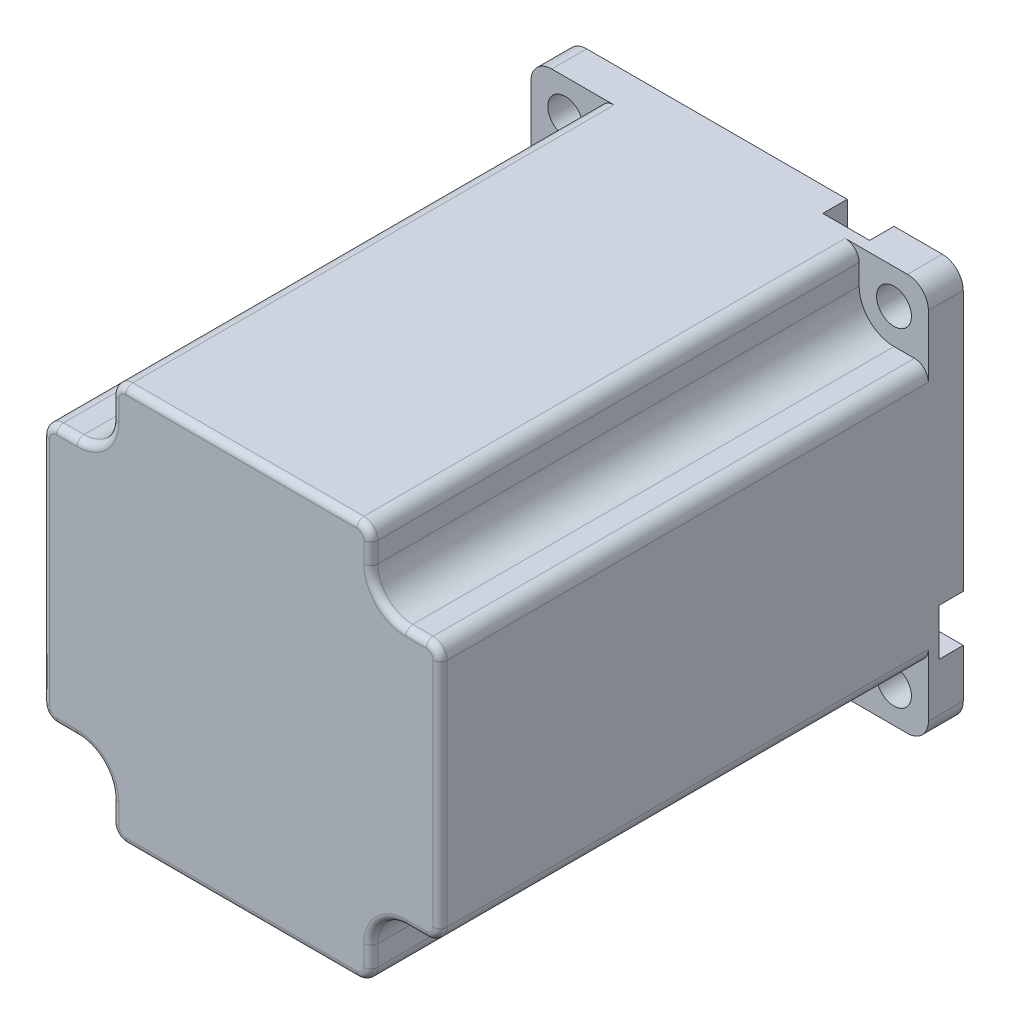
from build123d import *

# Parameters (mm, degrees)
BOSS_EXTRUDE1_DEPTH          = 54.00000000000001
CUT_EXTRUDE1_REACH           = 79.096
SKETCH4_W                    = 49.00000000000001
SKETCH4_H                    = 9.930000000000003
CUT_EXTRUDE2_DEPTH           = 9.930000000000001
CUT_EXTRUDE3_DEPTH           = 9.930000000000001
CUT_EXTRUDE4_REACH           = 79.096
CUT_EXTRUDE5_DEPTH           = 3.5
CUT_EXTRUDE6_DEPTH           = 3.5
CUT_EXTRUDE7_DEPTH           = 3.5
CUT_EXTRUDE8_DEPTH           = 3.5
DRAFT1_ANGLE                 = 0.01722183664478431
F_5_0_5_DIAMETER_HOLE1_D     = 5
F_5_0_5_DIAMETER_HOLE1_DEPTH = 29.6
F_5_0_5_DIAMETER_HOLE2_D     = 5
F_5_0_5_DIAMETER_HOLE2_DEPTH = 26.5
FILLET1_R                    = 2
FILLET2_R                    = 5
FILLET3_R                    = 0.4999999999999998
FILLET5_R                    = 2.9999999999999996
BOSS_EXTRUDE2_DEPTH          = 21
FILLET4_R                    = 0.9999999999999991


with BuildPart() as part:
    # Sketch1 → Boss-Extrude1 (new body)
    with BuildSketch(Plane(origin=(0, 0, 0), x_dir=(-1, 0, 0), z_dir=(0, 0, -1))):
        Polygon((-28.5, 28.5), (-28.5, -28.51414849795304), (28.5, -28.49701556553382), (28.5, 28.5), align=None)
    extrude(amount=-BOSS_EXTRUDE1_DEPTH)

    # Cut-Extrude1: up to this plane
    cut_extrude1_end = Plane(origin=(28.5, -28.51414849795304, 54.00000000000001), z_dir=(-0.0003005777481625158, -0.9999999548265077, 0))
    # Sketch3 → Cut-Extrude1 (cut, up to the surface)
    with BuildSketch(Plane(origin=(0, -18.57, 0), x_dir=(1, 0, 0), z_dir=(0, 1, 0)), mode=Mode.PRIVATE) as cut_extrude1_sk1:
        Polygon((28.499999999999996, -5.000000000000003), (18.57, -5.000000000000004), (18.570000000000004, -54), (28.499999999999996, -53.99999999999999), align=None)
    cut_extrude1_tool1 = split(extrude(cut_extrude1_sk1.sketch, amount=-CUT_EXTRUDE1_REACH, mode=Mode.PRIVATE), bisect_by=cut_extrude1_end, keep=Keep.BOTH, mode=Mode.PRIVATE)
    add(cut_extrude1_tool1.solids().sort_by_distance((23.535, -18.57, 29.5))[0], mode=Mode.SUBTRACT)

    # Sketch4 → Cut-Extrude2 (cut)
    with BuildSketch(Plane(origin=(28.5, 0, 0), x_dir=(0, 0, -1), z_dir=(1, 0, 0))):
        with Locations((-29.500000000000004, 23.535000000000004)):
            Rectangle(SKETCH4_W, SKETCH4_H)
    extrude(amount=-CUT_EXTRUDE2_DEPTH, mode=Mode.SUBTRACT)

    # Sketch5 → Cut-Extrude3 (cut)
    with BuildSketch(Plane(origin=(0, 28.5, 0), x_dir=(-1, 0, 0), z_dir=(0, 1, 0))):
        Polygon((18.570000000000004, 5.000000000000003), (28.499999999999996, 5.000000000000003), (28.5, 54), (18.57, 54), align=None)
    extrude(amount=-CUT_EXTRUDE3_DEPTH, mode=Mode.SUBTRACT)

    # Cut-Extrude4: up to this plane
    cut_extrude4_end = Plane(origin=(28.5, -28.51414849795304, 54.00000000000001), z_dir=(-0.0003005777481625158, -0.9999999548265077, 0))
    # Sketch7 → Cut-Extrude4 (cut, up to the surface)
    with BuildSketch(Plane(origin=(0, -18.57, 0), x_dir=(1, 0, 0), z_dir=(0, 1, 0)), mode=Mode.PRIVATE) as cut_extrude4_sk1:
        Polygon((-18.569999999999997, -5.000000000000004), (-28.499999999999996, -5.000000000000003), (-28.5, -54), (-18.569999999999997, -53.99999999999999), align=None)
    cut_extrude4_tool1 = split(extrude(cut_extrude4_sk1.sketch, amount=-CUT_EXTRUDE4_REACH, mode=Mode.PRIVATE), bisect_by=cut_extrude4_end, keep=Keep.BOTH, mode=Mode.PRIVATE)
    add(cut_extrude4_tool1.solids().sort_by_distance((-23.535, -18.57, 29.5))[0], mode=Mode.SUBTRACT)

    # Sketch8 → Cut-Extrude5 (cut)
    with BuildSketch(Plane(origin=(0, 0, 0), x_dir=(-1, 0, 0), z_dir=(0, 0, -1))):
        with BuildLine():
            Line((18.5710070868336, -28.5), (18.569999848669397, -25.148993064543653))
            ThreePointArc((18.569999848669397, -25.148993064543653), (15.21959273974545, -21.800000024754763), (11.870000005525402, -25.149807585039706))
            Line((11.870000005525402, -25.149807585039706), (11.869807463820973, -28.502014231583665))
            Line((11.869807463820973, -28.502014231583665), (18.5710070868336, -28.5))
        make_face()
    extrude(amount=-CUT_EXTRUDE5_DEPTH, mode=Mode.SUBTRACT)

    # Sketch9 → Cut-Extrude6 (cut)
    with BuildSketch(Plane(origin=(0, 0, 0), x_dir=(-1, 0, 0), z_dir=(0, 0, -1))):
        with BuildLine():
            Line((-18.57, 28.5), (-18.57, 25.15))
            ThreePointArc((-18.57, 25.15), (-15.22, 21.799999999999997), (-11.87, 25.15))
            Line((-11.87, 25.15), (-11.87, 28.5))
            Line((-11.87, 28.5), (-18.57, 28.5))
        make_face()
    extrude(amount=-CUT_EXTRUDE6_DEPTH, mode=Mode.SUBTRACT)

    # Sketch10 → Cut-Extrude7 (cut)
    with BuildSketch(Plane(origin=(0, 0, 0), x_dir=(-1, 0, 0), z_dir=(0, 0, -1))):
        with BuildLine():
            Line((-25.15, -11.870000000000003), (-28.5, -11.87))
            Line((-28.5, -11.87), (-28.5, -18.57))
            Line((-28.5, -18.57), (-25.15, -18.57))
            ThreePointArc((-25.15, -18.57), (-21.799999999999997, -15.22), (-25.15, -11.870000000000003))
        make_face()
    extrude(amount=-CUT_EXTRUDE7_DEPTH, mode=Mode.SUBTRACT)

    # Sketch11 → Cut-Extrude8 (cut)
    with BuildSketch(Plane(origin=(0, 0, 0), x_dir=(-1, 0, 0), z_dir=(0, 0, -1))):
        with BuildLine():
            Line((28.5, 18.57), (25.15, 18.57))
            ThreePointArc((25.15, 18.57), (21.799999999999997, 15.22), (25.15, 11.869999999999992))
            Line((25.15, 11.869999999999992), (28.5, 11.87))
            Line((28.5, 11.87), (28.5, 18.57))
        make_face()
    extrude(amount=-CUT_EXTRUDE8_DEPTH, mode=Mode.SUBTRACT)

    # Draft1
    draft1_faces = [part.faces().sort_by_distance(p)[0] for p in [
        (0.17151026292326854, -28.505633583914378, 26.11567870035269),
    ]]
    draft(draft1_faces, Plane(origin=(-18.5710070868336, -28.5, 3.5), x_dir=(0.00030057774815282144, 0.9999999548265077, 0), z_dir=(0.9999999548265077, -0.00030057774815282144, 0)), DRAFT1_ANGLE)

    # Sketch12 → Revolve1 (revolve)
    with BuildSketch(Plane(origin=(0, 0, 0), x_dir=(1, 0, 0), z_dir=(0, 1, 0))):
        Polygon((3.2500000000000004, 24.6), (0, 24.6), (0, 0), (19.05, 0), (19.05, 1.6), (3.2500000000000004, 1.6000000000000008), align=None)
    revolve(axis=Axis((0, 0, -24.6), (0, 0, 1)))

    # Ø5.0 (5) Diameter Hole1
    with Locations(Plane.XY.offset(5.000000000000008)):
        with Locations((23.57, -23.57), (23.57, 23.57), (-23.57, 23.57), (-23.57, -23.57)):
            Hole(F_5_0_5_DIAMETER_HOLE1_D / 2, depth=F_5_0_5_DIAMETER_HOLE1_DEPTH)

    # Ø5.0 (5) Diameter Hole2
    with Locations(Plane(origin=(0, 0, 3.5), x_dir=(-1, 0, 0), z_dir=(0, 0, -1))):
        with Locations((15.22, -25.15), (-25.15, -15.22), (-15.22, 25.15), (25.15, 15.22)):
            Hole(F_5_0_5_DIAMETER_HOLE2_D / 2, depth=F_5_0_5_DIAMETER_HOLE2_DEPTH)

    # Fillet1
    fillet1_edges = [part.edges().sort_by_distance(p)[0] for p in [
        (28.499999999999996, -18.57, 29.499999999999996),
        (18.570000000000004, -28.49999999999951, 29.50000000000001),
        (18.57, 28.5, 29.500000000000004),
        (28.5, 18.57, 29.5),
        (-28.499999999999996, 18.57, 29.500000000000004),
        (-18.57, 28.5, 29.5),
        (-28.499999999999996, -18.57, 29.500000000000004),
        (-18.57, -28.5, 29.500000000000007),
    ]]
    fillet(fillet1_edges, radius=FILLET1_R)

    # Fillet2
    fillet2_edges = [part.edges().sort_by_distance(p)[0] for p in [
        (18.57, -18.57, 29.5),
        (18.57, 18.57, 29.5),
        (-18.57, 18.57, 29.5),
        (-18.569999999999997, -18.57, 29.5),
    ]]
    fillet(fillet2_edges, radius=FILLET2_R)

    # Fillet3
    fillet3_edges = [part.edges().sort_by_distance(p)[0] for p in [
        (-3.2500000000000004, 4e-16, -24.6),
    ]]
    fillet(fillet3_edges, radius=FILLET3_R)

    # Fillet5
    fillet5_edges = [part.edges().sort_by_distance(p)[0] for p in [
        (28.5, -28.499999999999375, 2.5000000000000013),
        (28.5, 28.5, 2.5000000000000013),
        (-28.5, 28.5, 2.5000000000000013),
        (-28.5, -28.500000000000135, 2.5000000000000013),
    ]]
    fillet(fillet5_edges, radius=FILLET5_R)

    # Sketch17 → Boss-Extrude2 (add)
    with BuildSketch(Plane.XY.offset(54.00000000000001)):
        with BuildLine():
            Line((-16.570000000000007, 28.5), (16.569999999999983, 28.5))
            ThreePointArc((16.569999999999983, 28.5), (17.98421356237308, 27.914213562373096), (18.57, 26.500000000000004))
            Line((18.57, 26.500000000000004), (18.57, 23.57))
            ThreePointArc((18.57, 23.57), (20.034466094067263, 20.034466094067263), (23.57, 18.57))
            Line((23.57, 18.57), (26.499999999999996, 18.57))
            ThreePointArc((26.499999999999996, 18.57), (27.914213562373096, 17.984213562373093), (28.5, 16.569999999999993))
            Line((28.5, 16.569999999999993), (28.500000000000004, -16.569999999999997))
            ThreePointArc((28.500000000000004, -16.569999999999997), (27.9142135623731, -17.984213562373093), (26.500000000000004, -18.57))
            Line((26.500000000000004, -18.57), (23.569999999999986, -18.57))
            ThreePointArc((23.569999999999986, -18.57), (20.034466094067255, -20.034466094067263), (18.57, -23.57))
            Line((18.57, -23.57), (18.570000000000004, -26.499999999999538))
            ThreePointArc((18.570000000000004, -26.499999999999538), (17.98421356237311, -27.914213562372627), (16.57000000000003, -28.499999999999535))
            Line((16.57000000000003, -28.499999999999535), (-16.56999999999997, -28.49999999999997))
            ThreePointArc((-16.56999999999997, -28.49999999999997), (-17.98421356237307, -27.91421356237308), (-18.569999999999993, -26.49999999999999))
            Line((-18.569999999999993, -26.49999999999999), (-18.569999999999997, -23.57))
            ThreePointArc((-18.569999999999997, -23.57), (-20.034466094067266, -20.034466094067255), (-23.570000000000014, -18.57))
            Line((-23.570000000000014, -18.57), (-26.500000000000004, -18.57))
            ThreePointArc((-26.500000000000004, -18.57), (-27.9142135623731, -17.984213562373096), (-28.5, -16.57))
            Line((-28.5, -16.57), (-28.5, 16.57))
            ThreePointArc((-28.5, 16.57), (-27.914213562373096, 17.984213562373093), (-26.500000000000004, 18.57))
            Line((-26.500000000000004, 18.57), (-23.570000000000004, 18.57))
            ThreePointArc((-23.570000000000004, 18.57), (-20.034466094067266, 20.034466094067263), (-18.57, 23.57))
            Line((-18.57, 23.57), (-18.570000000000004, 26.500000000000004))
            ThreePointArc((-18.570000000000004, 26.500000000000004), (-17.984213562373103, 27.9142135623731), (-16.570000000000007, 28.5))
        make_face()
    extrude(amount=BOSS_EXTRUDE2_DEPTH)

    # Fillet4
    fillet4_edges = [part.edges().sort_by_distance(p)[0] for p in [
        (-17.984213562373103, 27.9142135623731, 75),
        (-18.57, 25.035000000000004, 75),
        (-20.034466094067266, 20.034466094067263, 75),
        (-25.035000000000004, 18.57, 75),
        (-27.914213562373096, 17.984213562373093, 75),
        (-28.5, 0, 75),
        (-27.9142135623731, -17.984213562373096, 75),
        (-25.03500000000001, -18.57, 75),
        (-20.034466094067263, -20.034466094067255, 75),
        (-18.569999999999993, -25.034999999999997, 75),
        (-17.98421356237307, -27.91421356237308, 75),
        (2.842e-14, -28.49999999999975, 75),
        (17.98421356237311, -27.914213562372627, 75),
        (18.57, -25.03499999999977, 75),
        (20.034466094067252, -20.034466094067263, 75),
        (25.034999999999997, -18.57, 75),
        (27.9142135623731, -17.984213562373093, 75),
        (28.5, 0, 75),
        (27.914213562373096, 17.984213562373093, 75),
        (25.034999999999997, 18.57, 75),
        (20.034466094067263, 20.034466094067263, 75),
        (18.57, 25.035000000000004, 75),
        (17.984213562373082, 27.914213562373096, 75),
        (-1.421e-14, 28.5, 75),
    ]]
    fillet(fillet4_edges, radius=FILLET4_R)


solid = part.part
